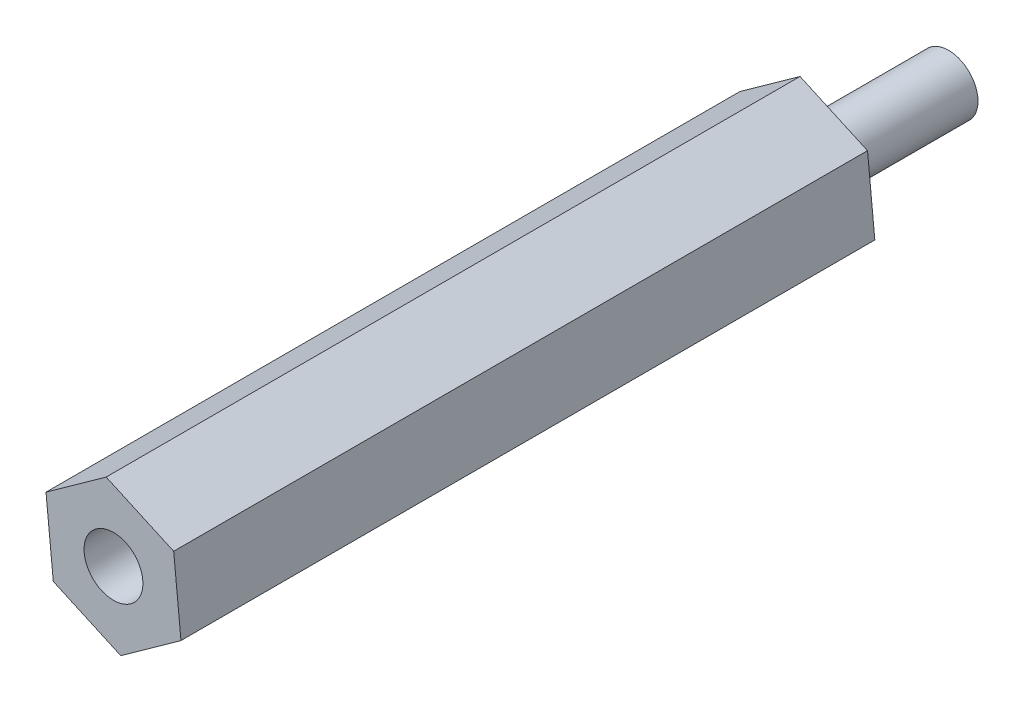
from build123d import *

# Parameters (mm, degrees)
BOSS_EXTRUDE1_DEPTH = 29.9466
SKETCH2_R           = 1.27
CUT_EXTRUDE1_DEPTH  = 24.8666
SKETCH3_R           = 1.27
BOSS_EXTRUDE2_DEPTH = 6.096


with BuildPart() as part:
    # Sketch1 → Boss-Extrude1 (new body)
    with BuildSketch(Plane.XY):
        Polygon((-2.597606711, -1.863500467), (0.315035389, -3.181343634), (2.912642099, -1.317843167), (2.597606711, 1.863500467), (-0.315035389, 3.181343634), (-2.912642099, 1.317843167), align=None)
    extrude(amount=BOSS_EXTRUDE1_DEPTH)

    # Sketch2 → Cut-Extrude1 (cut)
    with BuildSketch(Plane.XY.offset(29.9466)):
        Circle(SKETCH2_R)
    extrude(amount=-CUT_EXTRUDE1_DEPTH, mode=Mode.SUBTRACT)

    # Sketch3 → Boss-Extrude2 (add)
    with BuildSketch(Plane(origin=(0, 0, 0), x_dir=(-1, 0, 0), z_dir=(0, 0, -1))):
        with Locations(Location((0, 0, 0), (0, 0, 180))):
            Circle(SKETCH3_R)
    extrude(amount=BOSS_EXTRUDE2_DEPTH)


solid = part.part
